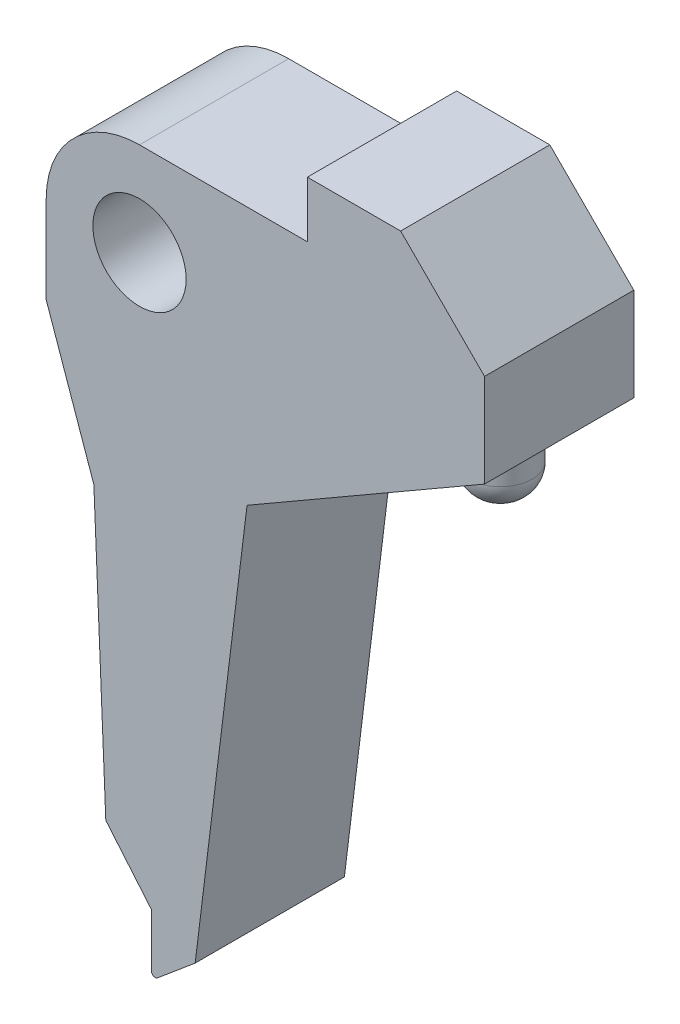
from build123d import *

# Parameters (mm, degrees)
SKETCH_1_R          = 2.5
EXTRUDE_1_DEPTH     = 8
CUT_EXTRUDE_1_REACH = 39.599
SKETCH_3_R          = 2.5
SKETCH_4_R          = 1.7
EXTRUDE_2_DEPTH     = 4
FILLET_1_R          = 1.5


with BuildPart() as part:
    # 스케치1 → 보스-돌출1 (new body)
    with BuildSketch(Plane.XY):
        with BuildLine():
            Line((0, 5), (9, 5))
            Line((9, 5), (9, 8))
            Line((9, 8), (14, 8))
            Line((14, 8), (18.5, 3.5))
            Line((18.5, 3.5), (18.5, -1.5))
            Line((18.5, -1.5), (5.766282201, -8.851815399))
            Line((5.766282201, -8.851815399), (2.9854348, -31.5))
            Line((2.9854348, -31.5), (0.968172025, -33.193012598))
            ThreePointArc((0.968172025, -33.193012598), (0.755084879, -33.221081572), (0.63959988, -33.039815981))
            Line((0.63959988, -33.039815981), (0.63959988, -30.183726788))
            Line((0.63959988, -30.183726788), (-1.805734914, -27.269490262))
            Line((-1.805734914, -27.269490262), (-2.445573418, -12))
            Line((-2.445573418, -12), (-5, -4.696574134))
            Line((-5, -4.696574134), (-5, 0))
            ThreePointArc((-5, 0), (-3.535533906, 3.535533906), (0, 5))
        make_face()
        Circle(SKETCH_1_R, mode=Mode.SUBTRACT)
    extrude(amount=EXTRUDE_1_DEPTH)

    # 컷-돌출1: up to this plane
    cut_extrude_1_end = Plane(origin=(18.5, -1.5, 8), z_dir=(-0.5000000000000013, 0.8660254037844378, 0))
    # 스케치3 → 컷-돌출1 (cut, up to the surface)
    with BuildSketch(Plane(origin=(0, -1.5, 0), x_dir=(1, 0, 0), z_dir=(0, 1, 0)), mode=Mode.PRIVATE) as cut_extrude_1_sk1:
        with Locations(Location((15.349608759, -4, 0), (0, 0, 270))):
            Circle(SKETCH_3_R)
    cut_extrude_1_tool1 = split(extrude(cut_extrude_1_sk1.sketch, amount=-CUT_EXTRUDE_1_REACH, mode=Mode.PRIVATE), bisect_by=cut_extrude_1_end, keep=Keep.BOTH, mode=Mode.PRIVATE)
    add(cut_extrude_1_tool1.solids().sort_by_distance((15.349609, -1.5, 4))[0], mode=Mode.SUBTRACT)

    # 스케치4 → 보스-돌출2 (add)
    with BuildSketch(Plane.XZ.offset(1.5)):
        with Locations(Location((15.349608759, 4, 0), (0, 0, 90))):
            Circle(SKETCH_4_R)
    extrude(amount=EXTRUDE_2_DEPTH)

    # 필렛1
    fillet_1_edges = [part.edges().sort_by_distance(p)[0] for p in [
        (15.349608759, -5.5, 2.3),
    ]]
    fillet(fillet_1_edges, radius=FILLET_1_R)


solid = part.part
